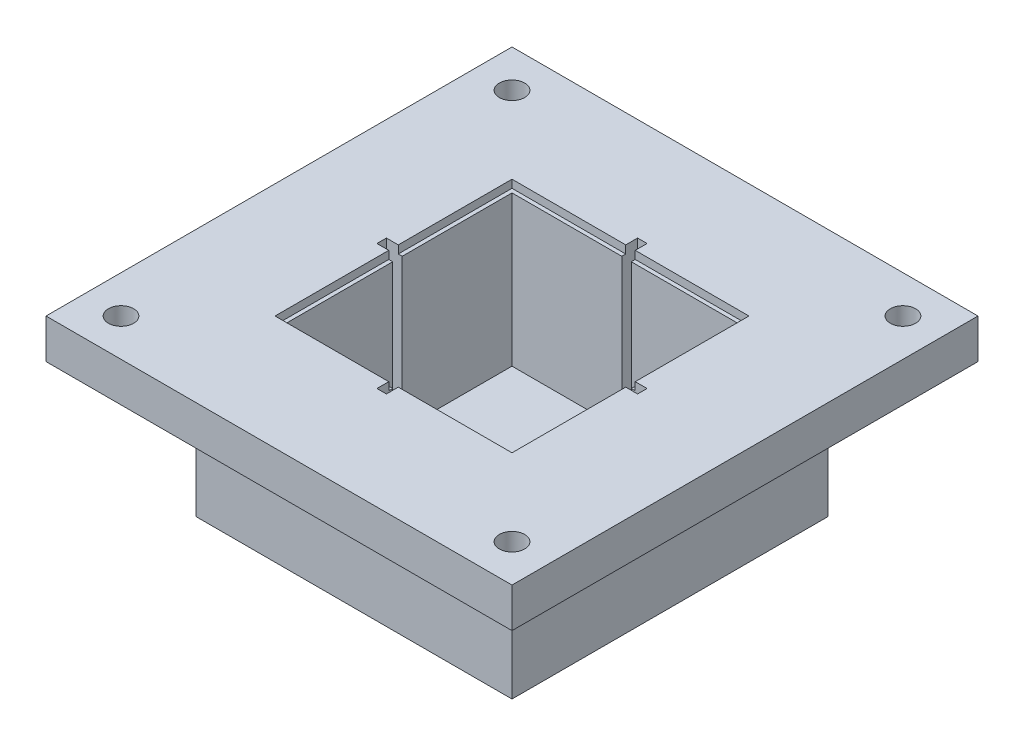
from build123d import *

# Parameters (mm, degrees)
CROQUIS1_W              = 40
CROQUIS1_H              = 40
SALIENTE_EXTRUIR1_DEPTH = 2
CROQUIS2_W              = 40
CROQUIS2_H              = 40
CROQUIS2_W_2            = 29
CROQUIS2_H_2            = 29
SALIENTE_EXTRUIR2_DEPTH = 15
CROQUIS3_W              = 59
CROQUIS3_H              = 59
CROQUIS3_W_2            = 29
CROQUIS3_H_2            = 29
SALIENTE_EXTRUIR3_DEPTH = 5
CORTAR_EXTRUIR1_DEPTH   = 20
CROQUIS5_R              = 1.6
CORTAR_EXTRUIR2_DEPTH   = 5
CROQUIS6_W              = 30
CROQUIS6_H              = 30
CORTAR_EXTRUIR3_DEPTH   = 1
CROQUIS7_W              = 3
CROQUIS7_H              = 3
CORTAR_EXTRUIR4_DEPTH   = 5


with BuildPart() as part:
    # Croquis1 → Saliente-Extruir1 (new body)
    with BuildSketch(Plane(origin=(0, 0, 0), x_dir=(1, 0, 0), z_dir=(0, 1, 0))):
        with Locations((20, 20)):
            Rectangle(CROQUIS1_W, CROQUIS1_H)
    extrude(amount=SALIENTE_EXTRUIR1_DEPTH)

    # Croquis2 → Saliente-Extruir2 (add)
    with BuildSketch(Plane(origin=(0, 2, 0), x_dir=(1, 0, 0), z_dir=(0, 1, 0))):
        with Locations((20, 20)):
            Rectangle(CROQUIS2_W, CROQUIS2_H)
        with Locations((20, 20)):
            Rectangle(CROQUIS2_W_2, CROQUIS2_H_2, mode=Mode.SUBTRACT)
    extrude(amount=SALIENTE_EXTRUIR2_DEPTH)

    # Croquis3 → Saliente-Extruir3 (add)
    with BuildSketch(Plane(origin=(0, 17, 0), x_dir=(1, 0, 0), z_dir=(0, 1, 0))):
        with Locations((20, 20)):
            Rectangle(CROQUIS3_W, CROQUIS3_H)
        with Locations((20, 20)):
            Rectangle(CROQUIS3_W_2, CROQUIS3_H_2, mode=Mode.SUBTRACT)
    extrude(amount=SALIENTE_EXTRUIR3_DEPTH)

    # Croquis4 → Cortar-Extruir1 (cut)
    with BuildSketch(Plane(origin=(0, 22, 0), x_dir=(1, 0, 0), z_dir=(0, 1, 0))):
        Polygon((19.4, 5.5), (19.4, 3.5), (20.6, 3.5), (20.6, 5.5), (34.5, 5.5), (34.5, 19.4), (36.5, 19.4), (36.5, 20.6), (34.5, 20.6), (34.5, 34.5), (20.6, 34.5), (20.6, 36.5), (19.4, 36.5), (19.4, 34.5), (5.5, 34.5), (5.5, 20.6), (3.5, 20.6), (3.5, 19.4), (5.5, 19.4), (5.5, 5.5), align=None)
    extrude(amount=-CORTAR_EXTRUIR1_DEPTH, mode=Mode.SUBTRACT)

    # Croquis5 → Cortar-Extruir2 (cut)
    with BuildSketch(Plane.XZ.offset(-17)):
        with Locations(Location((-4.75, 4.75, 0), (0, 0, 270))):
            Circle(CROQUIS5_R)
        with Locations(Location((44.75, 4.75, 0), (0, 0, 270))):
            Circle(CROQUIS5_R)
        with Locations(Location((44.75, -44.75, 0), (0, 0, 270))):
            Circle(CROQUIS5_R)
        with Locations(Location((-4.75, -44.75, 0), (0, 0, 270))):
            Circle(CROQUIS5_R)
    extrude(amount=-CORTAR_EXTRUIR2_DEPTH, mode=Mode.SUBTRACT)

    # Croquis6 → Cortar-Extruir3 (cut)
    with BuildSketch(Plane(origin=(0, 22, 0), x_dir=(1, 0, 0), z_dir=(0, 1, 0))):
        with Locations((20, 20)):
            Rectangle(CROQUIS6_W, CROQUIS6_H)
    extrude(amount=-CORTAR_EXTRUIR3_DEPTH, mode=Mode.SUBTRACT)

    # Croquis7 → Cortar-Extruir4 (cut)
    with BuildSketch(Plane(origin=(0, 2, 0), x_dir=(1, 0, 0), z_dir=(0, 1, 0))):
        with Locations((33, 7)):
            Rectangle(CROQUIS7_W, CROQUIS7_H)
    extrude(amount=-CORTAR_EXTRUIR4_DEPTH, mode=Mode.SUBTRACT)


solid = part.part
